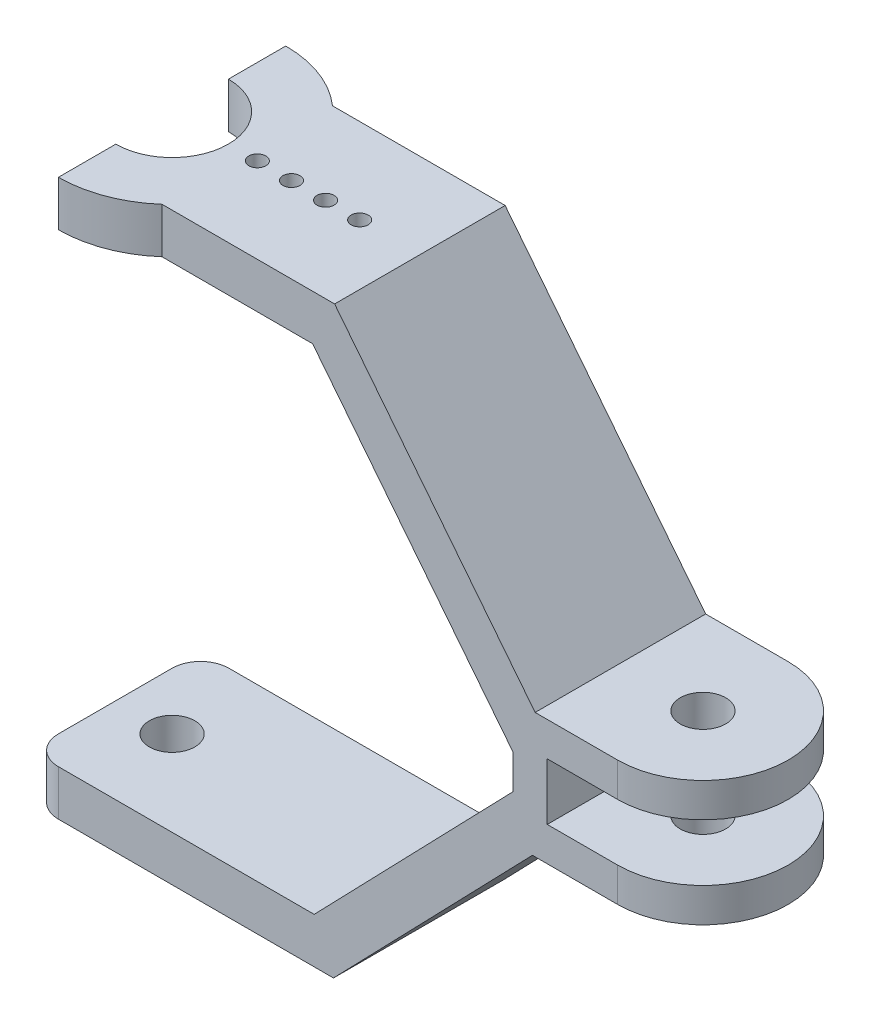
from build123d import *

# Parameters (mm, degrees)
EXTRUDE_1_DEPTH     = 15
SKETCH_2_R          = 2
CUT_EXTRUDE_1_DEPTH = 4
SKETCH_3_R          = 7.5
EXTRUDE_2_DEPTH     = 3
EXTRUDE_START       = -3
SKETCH_4_R          = 7.5
EXTRUDE_3_DEPTH     = 3
SKETCH_5_R          = 2
CUT_EXTRUDE_2_DEPTH = 11
EXTRUDE_4_DEPTH     = 4
SKETCH_6_R          = 0.75
CUT_EXTRUDE_3_DEPTH = 3
FILLET_1_R          = 2.5


with BuildPart() as part:
    # 草圖1 → 填料-伸長1 (new body)
    with BuildSketch(Plane.XY):
        Polygon((-24.89877099, 51.4), (-7.260334344, 29.1), (0, 29.1), (0, 26.1), (-6.196480976, 26.1), (-6.196480976, 21.1), (0, 21.1), (0, 18.1), (-7.5, 18.1), (-25, 0), (-51.696480976, 0), (-51.696480976, 4), (-47.696480976, 4), (-26.696480976, 4), (-9.196480976, 22.1), (-9.196480976, 25.1), (-16.981570729, 34.942567398), (-26.834917623, 47.4), (-41.746480973, 47.4), (-41.746480973, 51.4), align=None)
    extrude(amount=EXTRUDE_1_DEPTH)

    # 草圖2 → 除料-伸長1 (cut)
    with BuildSketch(Plane.XZ):
        with Locations((-46.696480976, 7.5)):
            Circle(SKETCH_2_R)
    extrude(amount=-CUT_EXTRUDE_1_DEPTH, mode=Mode.SUBTRACT)

    # 草圖3 → 填料-伸長2 (add)
    with BuildSketch(Plane.XZ.offset(-18.1)):
        with Locations((0, 7.5)):
            Circle(SKETCH_3_R)
    extrude(amount=-EXTRUDE_2_DEPTH)

    # 草圖4 → 填料-伸長3 (add)
    with BuildSketch(Plane(origin=(0, 29.1, 0), x_dir=(1, 0, 0), z_dir=(0, 1, 0)).offset(EXTRUDE_START)):
        with Locations((0, -7.5)):
            Circle(SKETCH_4_R)
    extrude(amount=EXTRUDE_3_DEPTH)

    # 草圖5 → 除料-伸長2 (cut)
    with BuildSketch(Plane(origin=(0, 29.1, 0), x_dir=(1, 0, 0), z_dir=(0, 1, 0))):
        with Locations(Location((0, -7.5, 0), (0, 0, 270))):
            Circle(SKETCH_5_R)
    extrude(amount=-CUT_EXTRUDE_2_DEPTH, mode=Mode.SUBTRACT)

    # 草圖7 → 填料-伸長4 (add)
    with BuildSketch(Plane(origin=(0, 51.4, 0), x_dir=(1, 0, 0), z_dir=(0, 1, 0))):
        with BuildLine():
            Line((-46.696480973, 2.5), (-46.696480973, -2.55))
            ThreePointArc((-46.696480973, -2.55), (-41.746480973, -7.5), (-46.696480973, -12.45))
            Line((-46.696480973, -12.45), (-46.696480973, -17.5))
            ThreePointArc((-46.696480973, -17.5), (-36.696480973, -7.5), (-46.696480973, 2.5))
        make_face()
    extrude(amount=-EXTRUDE_4_DEPTH)

    # 草圖6 → 除料-伸長3 (cut)
    with BuildSketch(Plane(origin=(0, 51.4, 0), x_dir=(1, 0, 0), z_dir=(0, 1, 0))):
        with Locations(Location((-39.196480973, -7.5, 0), (0, 0, 180))):
            Circle(SKETCH_6_R)
        with Locations(Location((-36.196480973, -7.5, 0), (0, 0, 180))):
            Circle(SKETCH_6_R)
        with Locations(Location((-33.196480973, -7.5, 0), (0, 0, 180))):
            Circle(SKETCH_6_R)
        with Locations(Location((-30.196480973, -7.5, 0), (0, 0, 180))):
            Circle(SKETCH_6_R)
    extrude(amount=-CUT_EXTRUDE_3_DEPTH, mode=Mode.SUBTRACT)

    # 圓角1
    fillet_1_edges = [part.edges().sort_by_distance(p)[0] for p in [
        (-51.696480976, 2, 0),
        (-51.696480976, 2, 15),
    ]]
    fillet(fillet_1_edges, radius=FILLET_1_R)


solid = part.part
